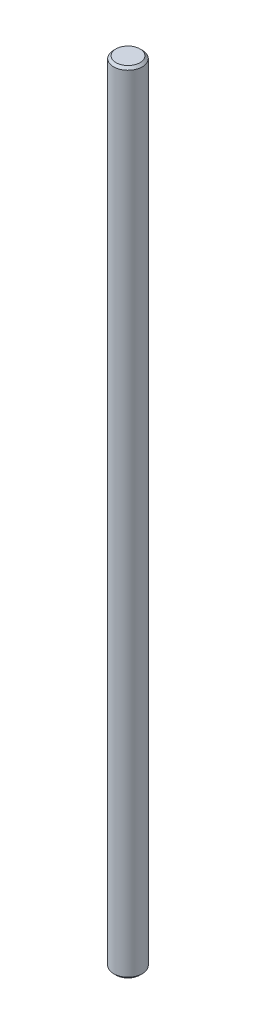
from build123d import *

# Parameters (mm, degrees)
SKETCH1_R      = 6
EXTRUDE1_DEPTH = 330
CHAMFER1_SIZE  = 1


with BuildPart() as part:
    # Sketch1 → Extrude1 (new body)
    with BuildSketch(Plane(origin=(0, 0, 0), x_dir=(1, 0, 0), z_dir=(0, 1, 0))):
        with Locations(Location((0, 0.010418865, 0), (0, 0, 270))):
            Circle(SKETCH1_R)
    extrude(amount=EXTRUDE1_DEPTH)

    # Chamfer1
    chamfer1_edges = [part.edges().sort_by_distance(p)[0] for p in [
        (0, 0, -6.010418865),
        (0, 330, -6.010418865),
    ]]
    chamfer(chamfer1_edges, length=CHAMFER1_SIZE)


solid = part.part
